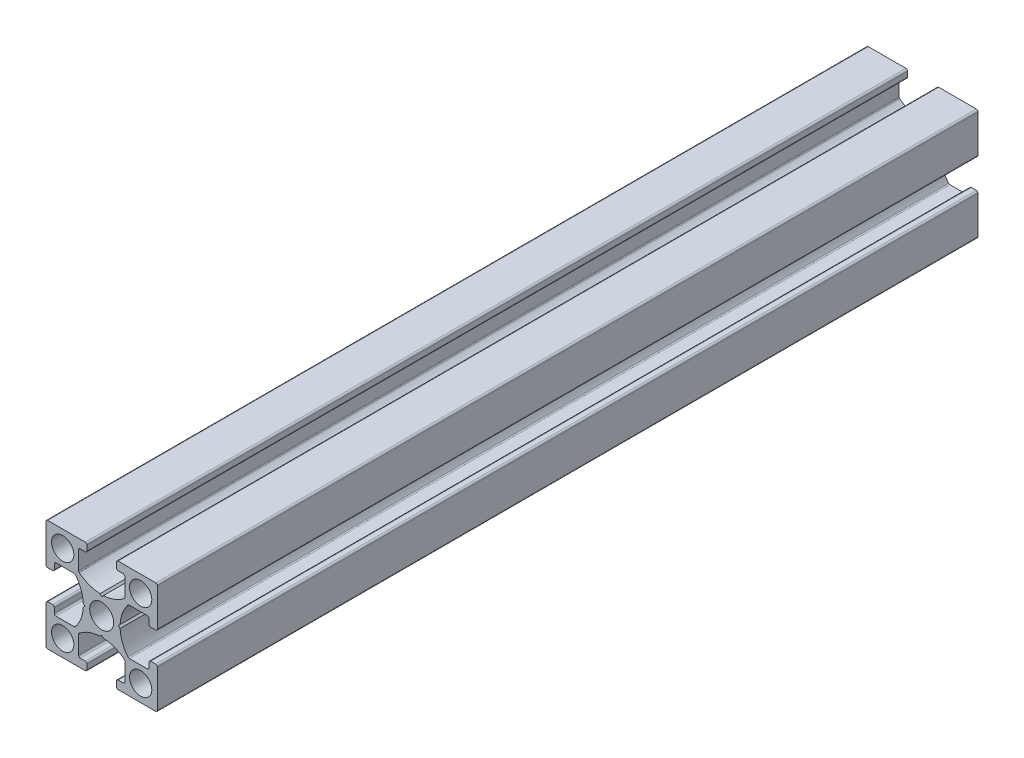
from build123d import *

# Parameters (mm, degrees)
MODEL_R             = 2.15
MODEL_R_2           = 2
EXTRUDE_1_DEPTH     = 147.38
SKETCH_1_R          = 2.5
CUT_EXTRUDE_1_DEPTH = 2319.389585148


with BuildPart() as part:
    # Model → 보스-돌출1 (new body)
    with BuildSketch(Plane.XY):
        with BuildLine():
            Line((2307.763927197, 1192.134297913), (2307.763927197, 1195.391548465))
            ThreePointArc((2307.763927197, 1195.391548465), (2307.676059232, 1195.603680499), (2307.463927197, 1195.691548465))
            Line((2307.463927197, 1195.691548465), (2306.563927197, 1195.691548465))
            ThreePointArc((2306.563927197, 1195.691548465), (2306.351795163, 1195.779416431), (2306.263927197, 1195.991548465))
            Line((2306.263927197, 1195.991548465), (2306.263927197, 1196.891548465))
            ThreePointArc((2306.263927197, 1196.891548465), (2306.351795163, 1197.103680499), (2306.563927197, 1197.191548465))
            Line((2306.563927197, 1197.191548465), (2313.313927197, 1197.191548465))
            ThreePointArc((2313.313927197, 1197.191548465), (2313.526059232, 1197.103680499), (2313.613927197, 1196.891548465))
            Line((2313.613927197, 1196.891548465), (2313.613927197, 1190.141548465))
            ThreePointArc((2313.613927197, 1190.141548465), (2313.526059232, 1189.929416431), (2313.313927197, 1189.841548465))
            Line((2313.313927197, 1189.841548465), (2312.413927197, 1189.841548465))
            ThreePointArc((2312.413927197, 1189.841548465), (2312.201795163, 1189.929416431), (2312.113927197, 1190.141548465))
            Line((2312.113927197, 1190.141548465), (2312.113927197, 1191.041548465))
            ThreePointArc((2312.113927197, 1191.041548465), (2312.026059232, 1191.253680499), (2311.813927197, 1191.341548465))
            Line((2311.813927197, 1191.341548465), (2308.556676645, 1191.341548465))
            ThreePointArc((2308.556676645, 1191.341548465), (2308.426234796, 1191.311705686), (2308.321744595, 1191.228114625))
            ThreePointArc((2308.321744595, 1191.228114625), (2307.328306374, 1189.47356999), (2306.921204563, 1187.498825831))
            Line((2306.921204563, 1187.498825831), (2306.613927197, 1187.191548465))
            Line((2306.613927197, 1187.191548465), (2306.921204563, 1186.884271099))
            ThreePointArc((2306.921204563, 1186.884271099), (2307.328306374, 1184.90952694), (2308.321744595, 1183.154982305))
            ThreePointArc((2308.321744595, 1183.154982305), (2308.426234796, 1183.071391244), (2308.556676645, 1183.041548465))
            Line((2308.556676645, 1183.041548465), (2311.813927197, 1183.041548465))
            ThreePointArc((2311.813927197, 1183.041548465), (2312.026059232, 1183.129416431), (2312.113927197, 1183.341548465))
            Line((2312.113927197, 1183.341548465), (2312.113927197, 1184.241548465))
            ThreePointArc((2312.113927197, 1184.241548465), (2312.201795163, 1184.453680499), (2312.413927197, 1184.541548465))
            Line((2312.413927197, 1184.541548465), (2313.313927197, 1184.541548465))
            ThreePointArc((2313.313927197, 1184.541548465), (2313.526059232, 1184.453680499), (2313.613927197, 1184.241548465))
            Line((2313.613927197, 1184.241548465), (2313.613927197, 1177.491548465))
            ThreePointArc((2313.613927197, 1177.491548465), (2313.526059232, 1177.279416431), (2313.313927197, 1177.191548465))
            Line((2313.313927197, 1177.191548465), (2306.563927197, 1177.191548465))
            ThreePointArc((2306.563927197, 1177.191548465), (2306.351795163, 1177.279416431), (2306.263927197, 1177.491548465))
            Line((2306.263927197, 1177.491548465), (2306.263927197, 1178.391548465))
            ThreePointArc((2306.263927197, 1178.391548465), (2306.351795163, 1178.603680499), (2306.563927197, 1178.691548465))
            Line((2306.563927197, 1178.691548465), (2307.463927197, 1178.691548465))
            ThreePointArc((2307.463927197, 1178.691548465), (2307.676059232, 1178.779416431), (2307.763927197, 1178.991548465))
            Line((2307.763927197, 1178.991548465), (2307.763927197, 1182.248799017))
            ThreePointArc((2307.763927197, 1182.248799017), (2307.734084418, 1182.379240866), (2307.650493357, 1182.483731067))
            ThreePointArc((2307.650493357, 1182.483731067), (2305.895948722, 1183.477169289), (2303.921204563, 1183.884271099))
            Line((2303.921204563, 1183.884271099), (2303.613927197, 1184.191548465))
            Line((2303.613927197, 1184.191548465), (2303.306649831, 1183.884271099))
            ThreePointArc((2303.306649831, 1183.884271099), (2301.331905673, 1183.477169289), (2299.577361038, 1182.483731067))
            ThreePointArc((2299.577361038, 1182.483731067), (2299.493769977, 1182.379240866), (2299.463927197, 1182.248799017))
            Line((2299.463927197, 1182.248799017), (2299.463927197, 1178.991548465))
            ThreePointArc((2299.463927197, 1178.991548465), (2299.551795163, 1178.779416431), (2299.763927197, 1178.691548465))
            Line((2299.763927197, 1178.691548465), (2300.663927197, 1178.691548465))
            ThreePointArc((2300.663927197, 1178.691548465), (2300.876059232, 1178.603680499), (2300.963927197, 1178.391548465))
            Line((2300.963927197, 1178.391548465), (2300.963927197, 1177.491548465))
            ThreePointArc((2300.963927197, 1177.491548465), (2300.876059232, 1177.279416431), (2300.663927197, 1177.191548465))
            Line((2300.663927197, 1177.191548465), (2293.913927197, 1177.191548465))
            ThreePointArc((2293.913927197, 1177.191548465), (2293.701795163, 1177.279416431), (2293.613927197, 1177.491548465))
            Line((2293.613927197, 1177.491548465), (2293.613927197, 1184.241548465))
            ThreePointArc((2293.613927197, 1184.241548465), (2293.701795163, 1184.453680499), (2293.913927197, 1184.541548465))
            Line((2293.913927197, 1184.541548465), (2294.813927197, 1184.541548465))
            ThreePointArc((2294.813927197, 1184.541548465), (2295.026059232, 1184.453680499), (2295.113927197, 1184.241548465))
            Line((2295.113927197, 1184.241548465), (2295.113927197, 1183.341548465))
            ThreePointArc((2295.113927197, 1183.341548465), (2295.201795163, 1183.129416431), (2295.413927197, 1183.041548465))
            Line((2295.413927197, 1183.041548465), (2298.671177749, 1183.041548465))
            ThreePointArc((2298.671177749, 1183.041548465), (2298.801619599, 1183.071391244), (2298.906109799, 1183.154982305))
            ThreePointArc((2298.906109799, 1183.154982305), (2299.899548021, 1184.90952694), (2300.306649831, 1186.884271099))
            Line((2300.306649831, 1186.884271099), (2300.613927197, 1187.191548465))
            Line((2300.613927197, 1187.191548465), (2300.306649831, 1187.498825831))
            ThreePointArc((2300.306649831, 1187.498825831), (2299.899548021, 1189.47356999), (2298.906109799, 1191.228114625))
            ThreePointArc((2298.906109799, 1191.228114625), (2298.801619599, 1191.311705686), (2298.671177749, 1191.341548465))
            Line((2298.671177749, 1191.341548465), (2295.413927197, 1191.341548465))
            ThreePointArc((2295.413927197, 1191.341548465), (2295.201795163, 1191.253680499), (2295.113927197, 1191.041548465))
            Line((2295.113927197, 1191.041548465), (2295.113927197, 1190.141548465))
            ThreePointArc((2295.113927197, 1190.141548465), (2295.026059232, 1189.929416431), (2294.813927197, 1189.841548465))
            Line((2294.813927197, 1189.841548465), (2293.913927197, 1189.841548465))
            ThreePointArc((2293.913927197, 1189.841548465), (2293.701795163, 1189.929416431), (2293.613927197, 1190.141548465))
            Line((2293.613927197, 1190.141548465), (2293.613927197, 1196.891548465))
            ThreePointArc((2293.613927197, 1196.891548465), (2293.701795163, 1197.103680499), (2293.913927197, 1197.191548465))
            Line((2293.913927197, 1197.191548465), (2300.663927197, 1197.191548465))
            ThreePointArc((2300.663927197, 1197.191548465), (2300.876059232, 1197.103680499), (2300.963927197, 1196.891548465))
            Line((2300.963927197, 1196.891548465), (2300.963927197, 1195.991548465))
            ThreePointArc((2300.963927197, 1195.991548465), (2300.876059232, 1195.779416431), (2300.663927197, 1195.691548465))
            Line((2300.663927197, 1195.691548465), (2299.763927197, 1195.691548465))
            ThreePointArc((2299.763927197, 1195.691548465), (2299.551795163, 1195.603680499), (2299.463927197, 1195.391548465))
            Line((2299.463927197, 1195.391548465), (2299.463927197, 1192.134297913))
            ThreePointArc((2299.463927197, 1192.134297913), (2299.493769977, 1192.003856063), (2299.577361038, 1191.899365863))
            ThreePointArc((2299.577361038, 1191.899365863), (2301.331905673, 1190.905927641), (2303.306649831, 1190.498825831))
            Line((2303.306649831, 1190.498825831), (2303.613927197, 1190.191548465))
            Line((2303.613927197, 1190.191548465), (2303.921204563, 1190.498825831))
            ThreePointArc((2303.921204563, 1190.498825831), (2305.895948722, 1190.905927641), (2307.650493357, 1191.899365863))
            ThreePointArc((2307.650493357, 1191.899365863), (2307.734084418, 1192.003856063), (2307.763927197, 1192.134297913))
        make_face()
        with Locations((2303.613927197, 1187.191548465)):
            Circle(MODEL_R, mode=Mode.SUBTRACT)
        with Locations((2296.613927197, 1194.191548465)):
            Circle(MODEL_R_2, mode=Mode.SUBTRACT)
        with Locations((2296.613927197, 1180.191548465)):
            Circle(MODEL_R_2, mode=Mode.SUBTRACT)
        with Locations((2310.613927197, 1194.191548465)):
            Circle(MODEL_R_2, mode=Mode.SUBTRACT)
        with Locations((2310.613927197, 1180.191548465)):
            Circle(MODEL_R_2, mode=Mode.SUBTRACT)
    extrude(amount=EXTRUDE_1_DEPTH)

    # 스케치1 → 컷-돌출1 (cut, through all)
    with BuildSketch(Plane(origin=(0, 1197.191548465, 0), x_dir=(1, 0, 0), z_dir=(0, 1, 0))):
        with Locations(Location((2303.613927197, -30, 0), (0, 0, 270))):
            Circle(SKETCH_1_R)
        with Locations(Location((2303.613927197, -117.38, 0), (0, 0, 270))):
            Circle(SKETCH_1_R)
        with Locations(Location((2303.613927197, -73.69, 0), (0, 0, 270))):
            Circle(SKETCH_1_R)
    extrude(amount=-CUT_EXTRUDE_1_DEPTH, mode=Mode.SUBTRACT)


solid = part.part
